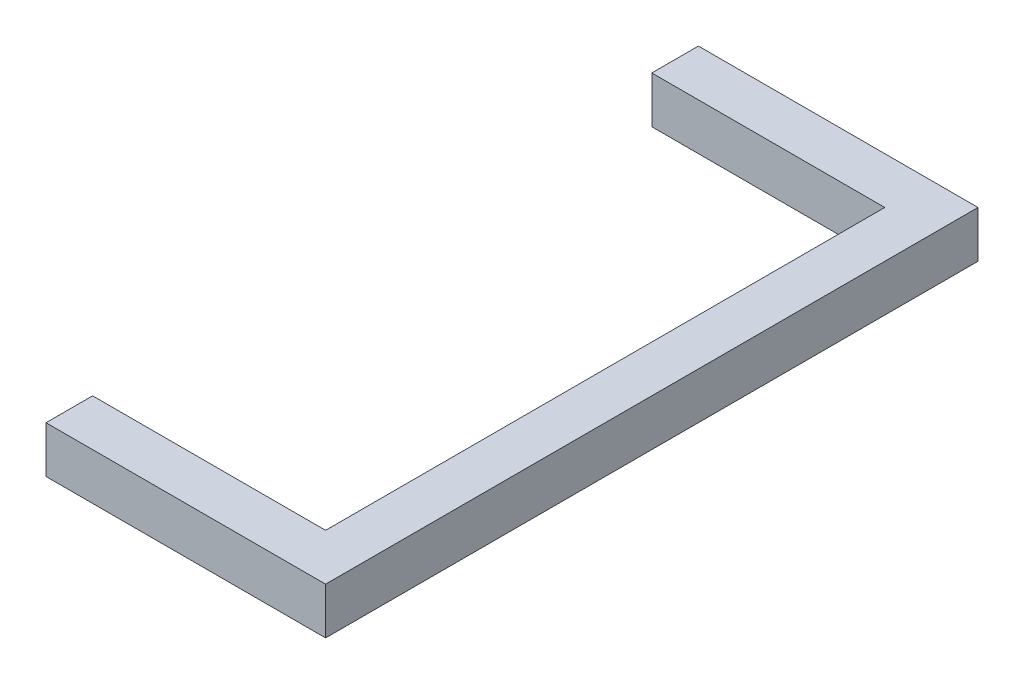
from build123d import *

# Parameters (mm, degrees)
BOSS_EXTRUDE1_DEPTH = 1.5875


with BuildPart() as part:
    # Sketch1 → Boss-Extrude1 (new, symmetric)
    with BuildSketch(Plane(origin=(0, 0, 0), x_dir=(1, 0, 0), z_dir=(0, 1, 0))):
        Polygon((3.175, -22.225), (3.175, 22.225), (-15.875, 22.225), (-15.875, 19.05), (0, 19.05), (0, -19.05), (-15.875, -19.05), (-15.875, -22.225), align=None)
    extrude(amount=BOSS_EXTRUDE1_DEPTH, both=True)


solid = part.part
